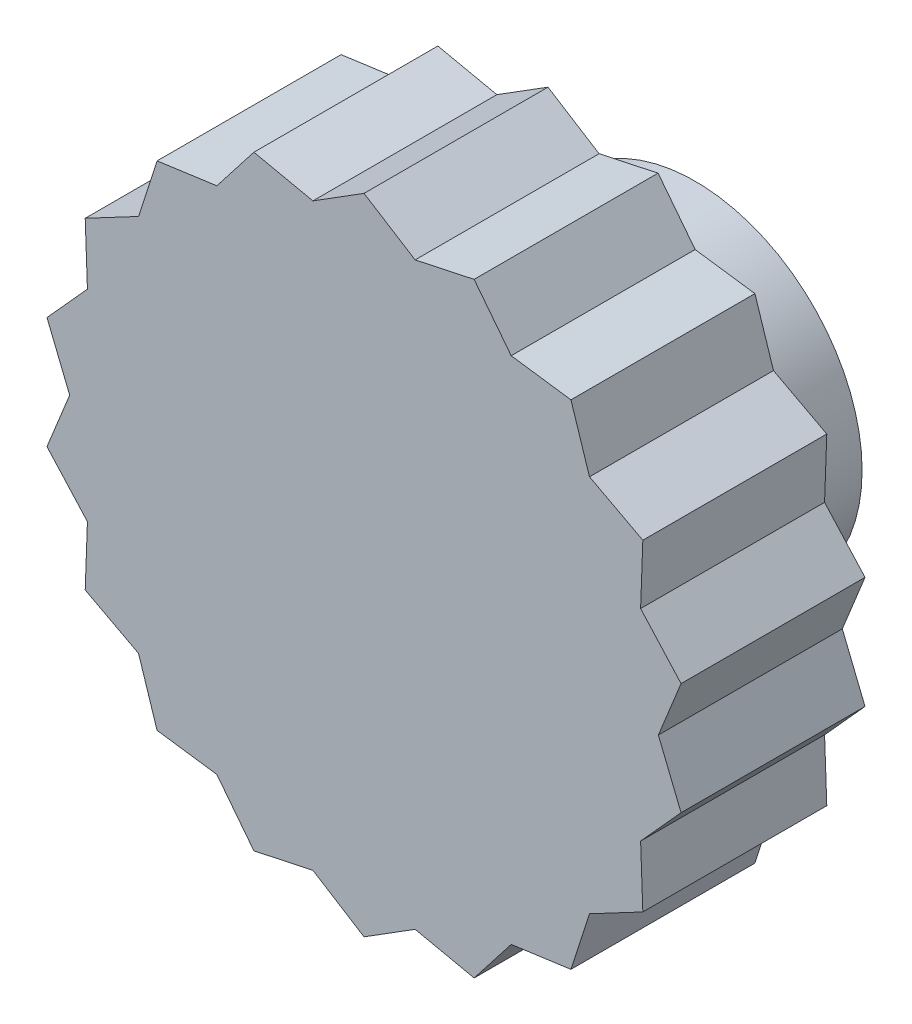
from build123d import *

# Parameters (mm, degrees)
CROQUIS1_R                 = 17.5
SALIENTE_EXTRUIR1_DEPTH    = 10
CROQUIS2_R                 = 9.075
CROQUIS2_R_2               = 4.075
SALIENTE_EXTRUIR2_DEPTH    = 8
CORTAR_EXTRUIR1_START      = -10
CROQUIS3_R                 = 19
CORTAR_EXTRUIR1_DEPTH      = 10
CORTAR_EXTRUIR2_DEPTH      = 27.519152184
CORTAR_EXTRUIR2_DEPTH_BACK = 27.519152184
CROQUIS4_R                 = 2.05
CORTAR_EXTRUIR3_START      = -5
CROQUIS5_R                 = 4.075
CORTAR_EXTRUIR3_DEPTH      = 5


with BuildPart() as part:
    # Croquis1 → Saliente-Extruir1 (new body)
    with BuildSketch(Plane.XY):
        Circle(CROQUIS1_R)
    extrude(amount=SALIENTE_EXTRUIR1_DEPTH)

    # Croquis2 → Saliente-Extruir2 (add)
    with BuildSketch(Plane(origin=(0, 0, 0), x_dir=(-1, 0, 0), z_dir=(0, 0, -1))):
        with Locations(Location((0, 0, 0), (0, 0, 180))):
            Circle(CROQUIS2_R)
        Circle(CROQUIS2_R_2, mode=Mode.SUBTRACT)
    extrude(amount=SALIENTE_EXTRUIR2_DEPTH)

    # Croquis3 → Cortar-Extruir1 (cut)
    with BuildSketch(Plane.XY.offset(10).offset(CORTAR_EXTRUIR1_START)):
        Circle(CROQUIS3_R)
        Polygon((0, 17.5), (2.778370843, 15.756924048), (5.985352508, 16.444620864), (8, 13.856406461), (11.24878317, 13.405777755), (12.25671109, 10.284601755), (15.155444566, 8.75), (15.035081933, 5.472322293), (17.234135678, 3.038843109), (16, 0), (17.234135678, -3.038843109), (15.035081933, -5.472322293), (15.155444566, -8.75), (12.25671109, -10.284601755), (11.24878317, -13.405777755), (8, -13.856406461), (5.985352508, -16.444620864), (2.778370843, -15.756924048), (0, -17.5), (-2.778370843, -15.756924048), (-5.985352508, -16.444620864), (-8, -13.856406461), (-11.24878317, -13.405777755), (-12.25671109, -10.284601755), (-15.155444566, -8.75), (-15.035081933, -5.472322293), (-17.234135678, -3.038843109), (-16, 0), (-17.234135678, 3.038843109), (-15.035081933, 5.472322293), (-15.155444566, 8.75), (-12.25671109, 10.284601755), (-11.24878317, 13.405777755), (-8, 13.856406461), (-5.985352508, 16.444620864), (-2.778370843, 15.756924048), align=None, mode=Mode.SUBTRACT)
    extrude(amount=CORTAR_EXTRUIR1_DEPTH, mode=Mode.SUBTRACT)

    # Croquis4 → Cortar-Extruir2 (cut, two sides: drawn at the far end of the back side and taken through both)
    with BuildSketch(Plane(origin=(0, 0, 0), x_dir=(1, 0, 0), z_dir=(0, 1, 0)).offset(-CORTAR_EXTRUIR2_DEPTH_BACK)):
        with Locations(Location((0, 3.75, 0), (0, 0, 270))):
            Circle(CROQUIS4_R)
    extrude(amount=CORTAR_EXTRUIR2_DEPTH + CORTAR_EXTRUIR2_DEPTH_BACK, mode=Mode.SUBTRACT)

    # Croquis5 → Cortar-Extruir3 (cut)
    with BuildSketch(Plane(origin=(0, 0, 0), x_dir=(-1, 0, 0), z_dir=(0, 0, -1)).offset(CORTAR_EXTRUIR3_START)):
        Circle(CROQUIS5_R)
    extrude(amount=CORTAR_EXTRUIR3_DEPTH, mode=Mode.SUBTRACT)


solid = part.part
